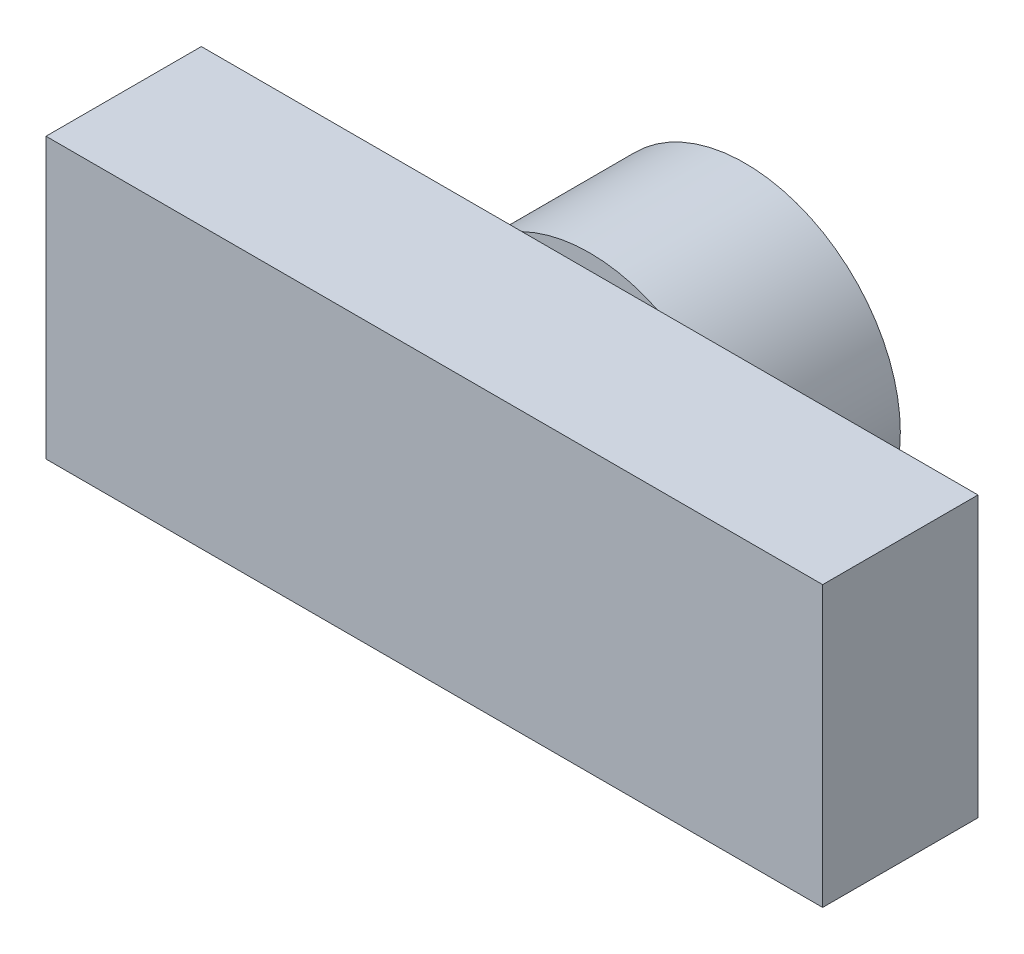
from build123d import *

# Parameters (mm, degrees)
SKETCH1_R           = 5
BOSS_EXTRUDE1_DEPTH = 5
SKETCH2_W           = 25
SKETCH2_H           = 9
BOSS_EXTRUDE2_DEPTH = 5


with BuildPart() as part:
    # Sketch1 → Boss-Extrude1 (new body)
    with BuildSketch(Plane.XY):
        Circle(SKETCH1_R)
    extrude(amount=BOSS_EXTRUDE1_DEPTH)

    # Sketch2 → Boss-Extrude2 (add)
    with BuildSketch(Plane.XY.offset(5)):
        Rectangle(SKETCH2_W, SKETCH2_H)
    extrude(amount=BOSS_EXTRUDE2_DEPTH)


solid = part.part
